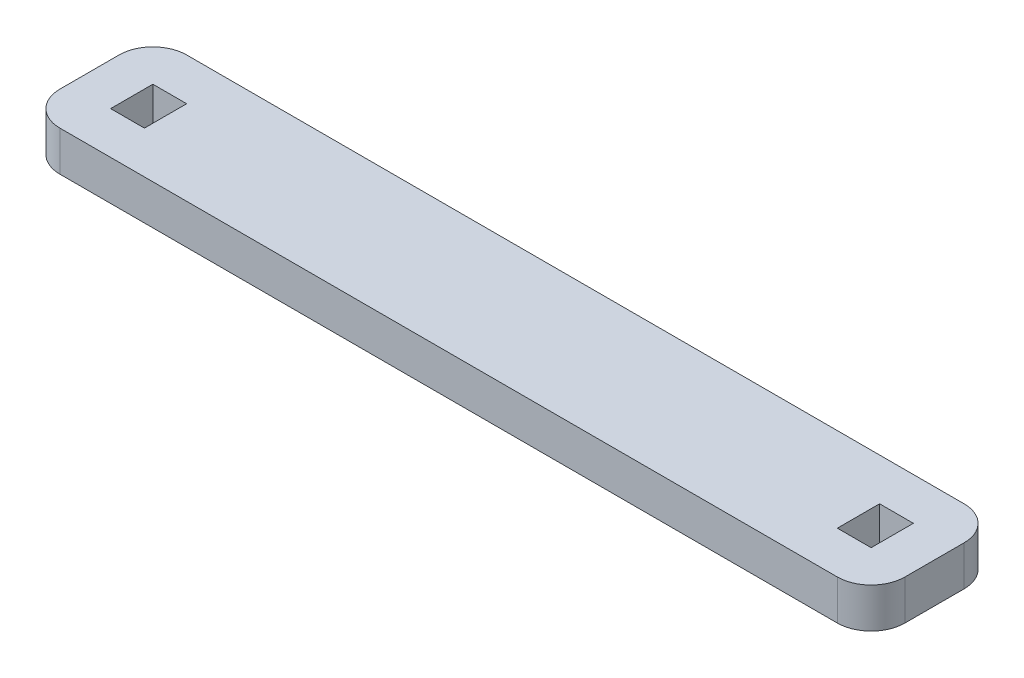
from build123d import *

# Parameters (mm, degrees)
SKETCH1_W           = 63.5
SKETCH1_H           = 9.525
SKETCH1_W_2         = 2.54
SKETCH1_H_2         = 3.175
BOSS_EXTRUDE1_DEPTH = 1.5
FILLET1_R           = 2.54


with BuildPart() as part:
    # Sketch1 → Boss-Extrude1 (new, symmetric)
    with BuildSketch(Plane(origin=(0, 0, 0), x_dir=(1, 0, 0), z_dir=(0, 1, 0))):
        Rectangle(SKETCH1_W, SKETCH1_H)
        with Locations((-27.305, 0)):
            Rectangle(SKETCH1_W_2, SKETCH1_H_2, mode=Mode.SUBTRACT)
        with Locations((27.305, 0)):
            Rectangle(SKETCH1_W_2, SKETCH1_H_2, mode=Mode.SUBTRACT)
    extrude(amount=BOSS_EXTRUDE1_DEPTH, both=True)

    # Fillet1
    fillet1_edges = [part.edges().sort_by_distance(p)[0] for p in [
        (-31.75, 0, -4.7625),
        (31.75, 0, -4.7625),
        (31.75, 0, 4.7625),
        (-31.75, 0, 4.7625),
    ]]
    fillet(fillet1_edges, radius=FILLET1_R)


solid = part.part
